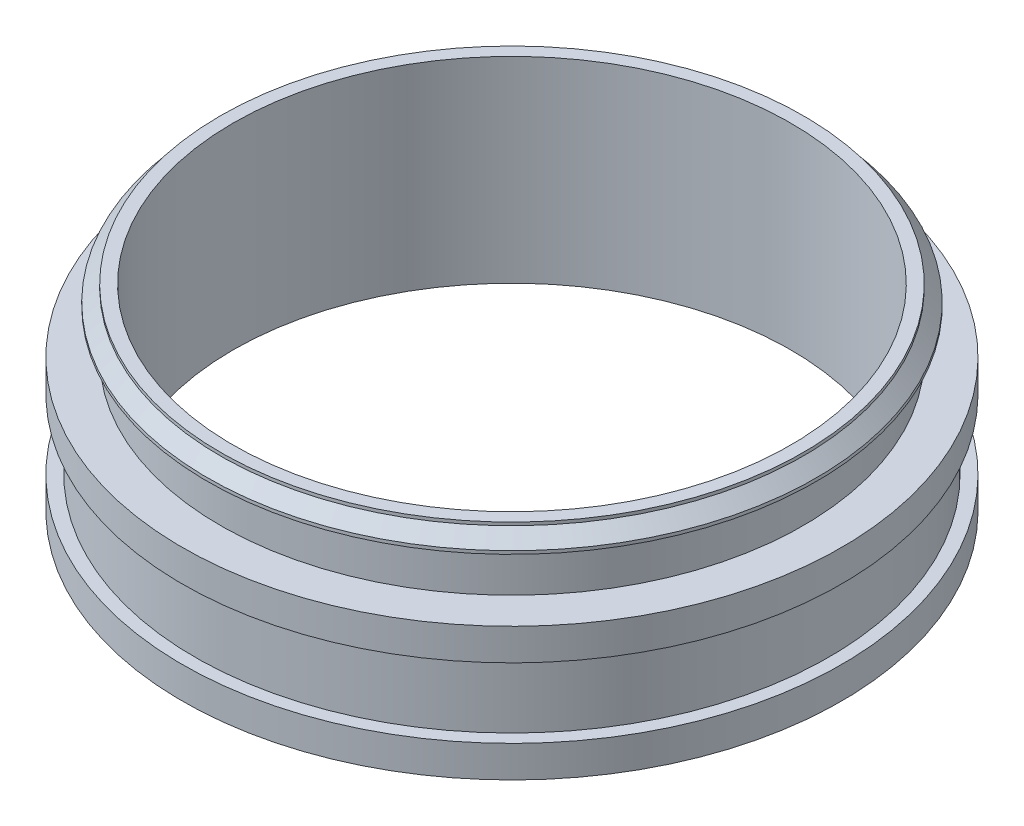
from build123d import *


with BuildPart() as part:
    # Sketch1 → Revolve1 (revolve)
    with BuildSketch(Plane(origin=(0, 0, 0), x_dir=(-1, 0, 0), z_dir=(0, 0, -1)), mode=Mode.PRIVATE) as revolve1_sk:
        Polygon((-46, 11.381196481), (-46, 4.381196481), (-52, 4.381196481), (-52, -0.618803519), (-50, -0.618803519), (-50, -11.618803519), (-52, -11.618803519), (-52, -16.618803519), (-44, -16.618803519), (-44, 14.381196481), (-46, 14.381196481), (-46, 13.881196481), (-48, 11.881196481), (-48, 11.381196481), align=None)
    revolve(revolve1_sk.sketch.rotate(Axis((0, -16.618803519, 0), (0, 1, 0)), 180), axis=Axis((0, -16.618803519, 0), (0, 1, 0)))


solid = part.part
